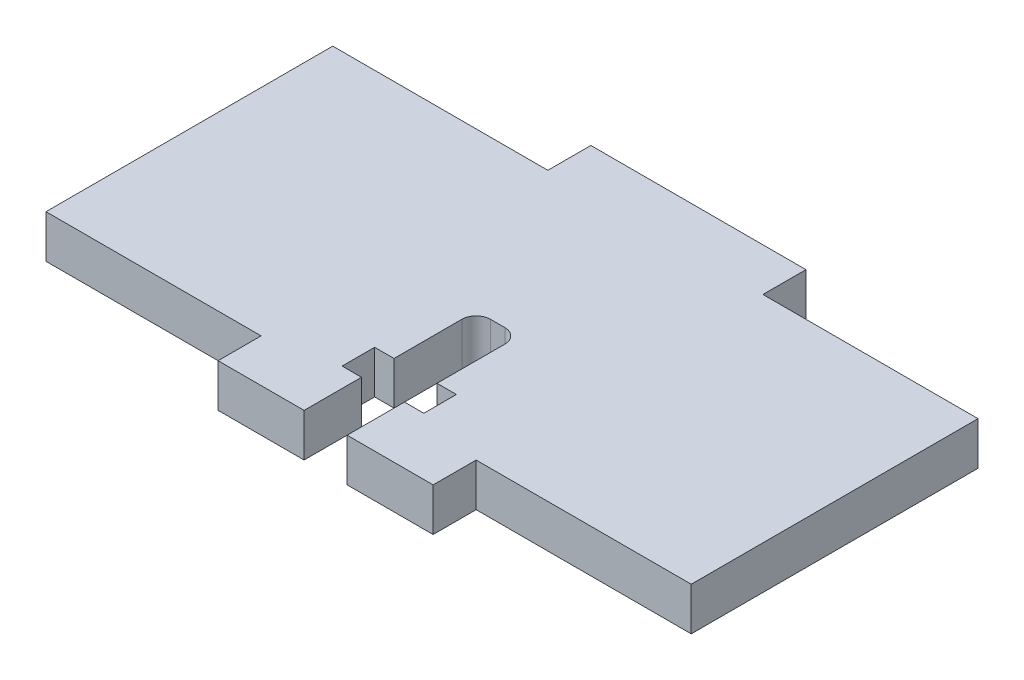
from build123d import *

# Parameters (mm, degrees)
SKETCH1_W               = 45
SKETCH1_H               = 20
BOSS_EXTRUDE1_DEPTH     = 1.5
SKETCH2_W               = 15
SKETCH2_H               = 3
BOSS_EXTRUDE2_DEPTH     = 1.5
CUT_EXTRUDE1_DEPTH      = 27.02883017
CUT_EXTRUDE1_DEPTH_BACK = 27.02883017


with BuildPart() as part:
    # Sketch1 → Boss-Extrude1 (new, symmetric)
    with BuildSketch(Plane(origin=(0, 0, 0), x_dir=(1, 0, 0), z_dir=(0, 1, 0))):
        Rectangle(SKETCH1_W, SKETCH1_H)
    extrude(amount=BOSS_EXTRUDE1_DEPTH, both=True)

    # Sketch2 → Boss-Extrude2 (add, symmetric)
    with BuildSketch(Plane(origin=(0, 0, 0), x_dir=(1, 0, 0), z_dir=(0, 1, 0))):
        with Locations((0, -11.5)):
            Rectangle(SKETCH2_W, SKETCH2_H)
        with Locations((0, 11.5)):
            Rectangle(SKETCH2_W, SKETCH2_H)
    extrude(amount=BOSS_EXTRUDE2_DEPTH, both=True)

    # Sketch3 → Cut-Extrude1 (cut, two sides: drawn at the far end of the back side and taken through both)
    with BuildSketch(Plane(origin=(0, 0, 0), x_dir=(1, 0, 0), z_dir=(0, 1, 0)).offset(-CUT_EXTRUDE1_DEPTH_BACK)):
        with BuildLine():
            Line((-1.5, -13), (1.5, -13))
            Line((1.5, -13), (1.5, -9))
            Line((1.5, -9), (2.85, -9))
            Line((2.85, -9), (2.85, -6.73))
            Line((2.85, -6.73), (1.5, -6.73))
            Line((1.5, -6.73), (1.5, -2))
            ThreePointArc((1.5, -2), (1.207106781, -1.292893219), (0.5, -1))
            Line((0.5, -1), (-0.5, -1))
            ThreePointArc((-0.5, -1), (-1.207106781, -1.292893219), (-1.5, -2))
            Line((-1.5, -2), (-1.5, -6.73))
            Line((-1.5, -6.73), (-2.85, -6.73))
            Line((-2.85, -6.73), (-2.85, -9))
            Line((-2.85, -9), (-1.5, -9))
            Line((-1.5, -9), (-1.5, -13))
        make_face()
    extrude(amount=CUT_EXTRUDE1_DEPTH + CUT_EXTRUDE1_DEPTH_BACK, mode=Mode.SUBTRACT)


solid = part.part
